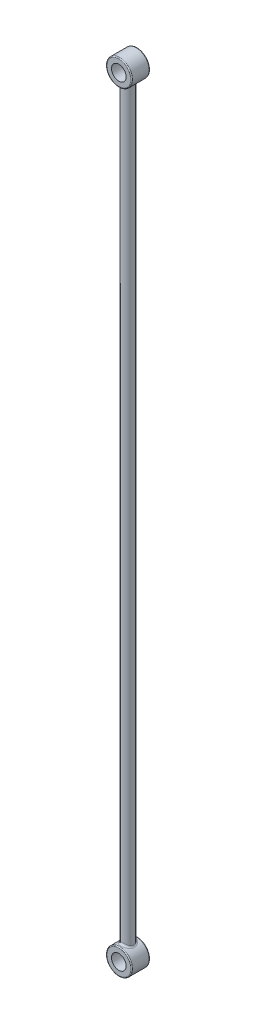
from build123d import *

# Parameters (mm, degrees)
SKETCH1_R           = 1.5
BOSS_EXTRUDE1_DEPTH = 102
SKETCH2_R           = 3.5
SKETCH2_R_2         = 2
BOSS_EXTRUDE2_DEPTH = 2.5
FILLET3_R           = 0.25
FILLET4_R           = 0.5


with BuildPart() as part:
    # Sketch1 → Boss-Extrude1 (new, symmetric)
    with BuildSketch(Plane(origin=(0, 0, 0), x_dir=(1, 0, 0), z_dir=(0, 1, 0))):
        with Locations(Location((0, 0, 0), (0, 0, 270))):
            Circle(SKETCH1_R)
    extrude(amount=BOSS_EXTRUDE1_DEPTH, both=True)

    # Sketch2 → Boss-Extrude2 (add, symmetric)
    # profile 1 of 2: a face of its own
    with BuildSketch(Plane.XY):
        with Locations((0, 105)):
            Circle(SKETCH2_R)
        with Locations((0, 105)):
            Circle(SKETCH2_R_2, mode=Mode.SUBTRACT)
    # profile 2 of 2: a face of its own
    with BuildSketch(Plane.XY):
        with Locations((0, -105)):
            Circle(SKETCH2_R)
        with Locations((0, -105)):
            Circle(SKETCH2_R_2, mode=Mode.SUBTRACT)
    extrude(amount=BOSS_EXTRUDE2_DEPTH, both=True)

    # Fillet3
    fillet3_edges = [part.edges().sort_by_distance(p)[0] for p in [
        (-3.5, -105, -2.5),
        (-3.5, -105, 2.5),
        (-3.5, 105, -2.5),
        (-3.5, 105, 2.5),
    ]]
    fillet(fillet3_edges, radius=FILLET3_R)

    # Fillet4
    fillet4_edges = [part.edges().sort_by_distance(p)[0] for p in [
        (3e-09, -101.5, -1.5),
        (3e-09, 101.5, -1.5),
    ]]
    fillet(fillet4_edges, radius=FILLET4_R)


solid = part.part
